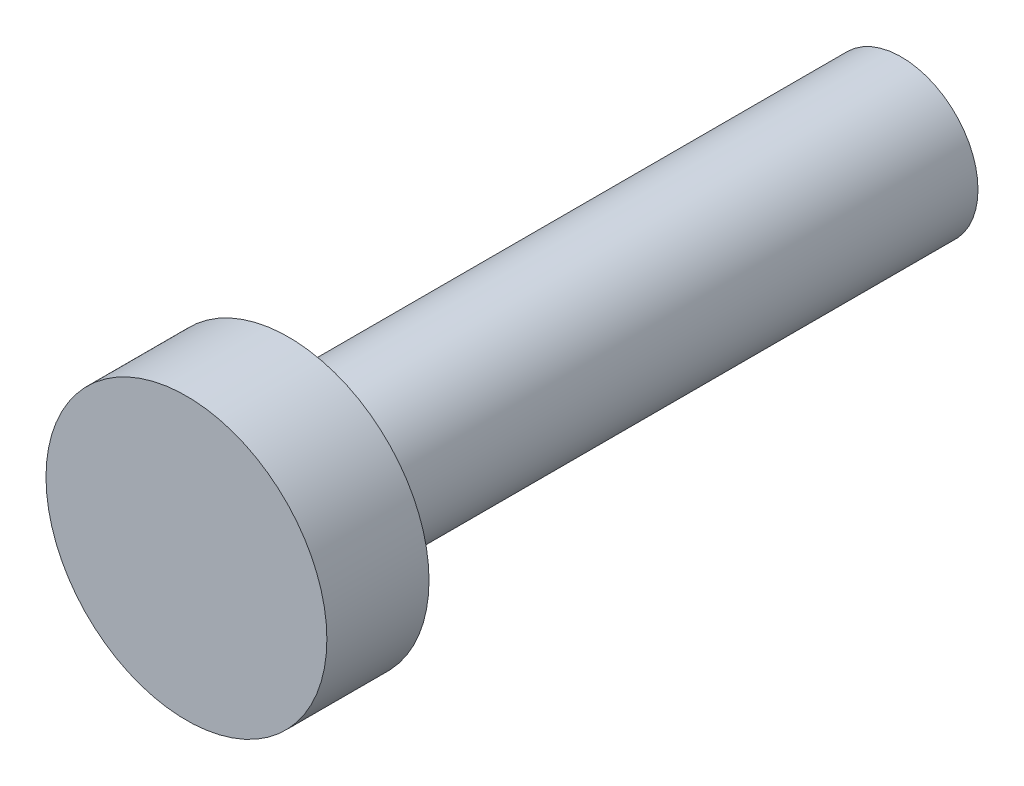
from build123d import *

# Parameters (mm, degrees)
EXTRUDE_START     = -12
SKETCH_1_R        = 1.5
EXTRUDE_M3_DEPTH  = 12
SKETCH_2_R        = 2.75
EXTRUDE_5_5_DEPTH = 2


with BuildPart() as part:
    # 草图1 → M3螺杆_牙型简化 (new body)
    with BuildSketch(Plane.XY.offset(EXTRUDE_START)):
        Circle(SKETCH_1_R)
    extrude(amount=EXTRUDE_M3_DEPTH)

    # 草图2 → 圆柱头_直径5.5 (add)
    with BuildSketch(Plane.XY):
        Circle(SKETCH_2_R)
    extrude(amount=EXTRUDE_5_5_DEPTH)


solid = part.part
